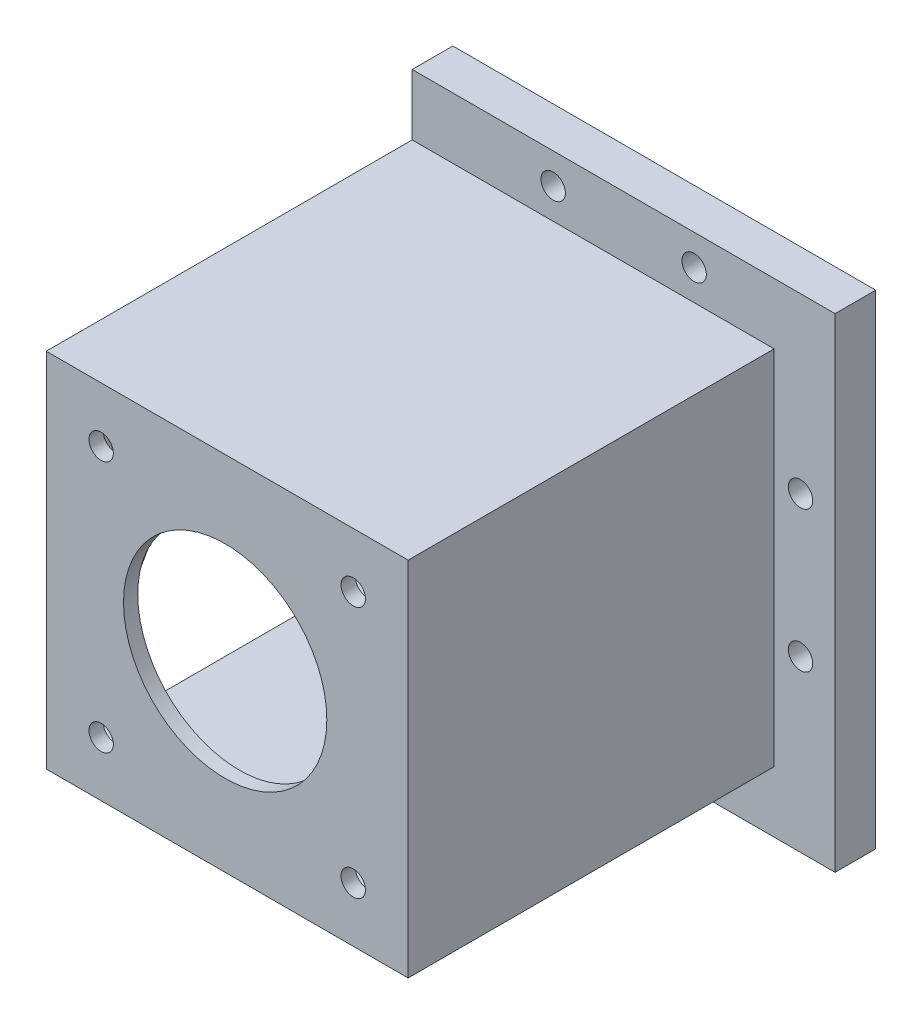
from build123d import *

# Parameters (mm, degrees)
SKETCH6_R           = 1.5
BOSS_EXTRUDE4_DEPTH = 5
SKETCH8_W           = 44.5
SKETCH8_H           = 44.5
SKETCH8_R           = 1.5
SKETCH8_R_2         = 12.5
BOSS_EXTRUDE5_DEPTH = 50
SKETCH7_W           = 43.5
SKETCH7_H           = 42.5
CUT_EXTRUDE4_DEPTH  = 48.25
BOSS_EXTRUDE6_DEPTH = 1


with BuildPart() as part:
    # Sketch6 → Boss-Extrude4 (new body)
    with BuildSketch(Plane.XY):
        Polygon((-437.521213625, -225.081134847), (-482.021213625, -225.081134847), (-482.021213625, -232.581134847), (-430.021213625, -232.581134847), (-430.021213625, -173.081134847), (-482.021213625, -173.081134847), (-482.021213625, -180.581134847), (-437.521213625, -180.581134847), align=None)
        with Locations((-464.687880625, -228.331134847)):
            Circle(SKETCH6_R, mode=Mode.SUBTRACT)
        with Locations((-447.354547625, -228.331134847)):
            Circle(SKETCH6_R, mode=Mode.SUBTRACT)
        with Locations((-434.271213625, -211.715651861)):
            Circle(SKETCH6_R, mode=Mode.SUBTRACT)
        with Locations((-464.687883625, -176.831134847)):
            Circle(SKETCH6_R, mode=Mode.SUBTRACT)
        with Locations((-434.271213625, -194.382318861)):
            Circle(SKETCH6_R, mode=Mode.SUBTRACT)
        with Locations((-447.354550625, -176.831134847)):
            Circle(SKETCH6_R, mode=Mode.SUBTRACT)
    extrude(amount=BOSS_EXTRUDE4_DEPTH)

    # Sketch8 → Boss-Extrude5 (add)
    with BuildSketch(Plane.XY):
        with Locations((-459.771213625, -202.831134847)):
            Rectangle(SKETCH8_W, SKETCH8_H)
        with Locations((-475.271213625, -218.331134847)):
            Circle(SKETCH8_R, mode=Mode.SUBTRACT)
        with Locations((-444.271213625, -218.331134847)):
            Circle(SKETCH8_R, mode=Mode.SUBTRACT)
        with Locations((-444.271213625, -187.331134847)):
            Circle(SKETCH8_R, mode=Mode.SUBTRACT)
        with Locations((-475.271213625, -187.331134847)):
            Circle(SKETCH8_R, mode=Mode.SUBTRACT)
        with Locations((-460.021213625, -202.581134847)):
            Circle(SKETCH8_R_2, mode=Mode.SUBTRACT)
    extrude(amount=BOSS_EXTRUDE5_DEPTH)

    # Sketch7 → Cut-Extrude4 (cut)
    with BuildSketch(Plane.XY):
        with Locations((-460.271213625, -202.831134847)):
            Rectangle(SKETCH7_W, SKETCH7_H)
    extrude(amount=CUT_EXTRUDE4_DEPTH, mode=Mode.SUBTRACT)

    # Sketch10 → Boss-Extrude6 (add)
    with BuildSketch(Plane.ZY.offset(482.021213625)):
        Polygon((24.125, -181.581134847), (48.25, -224.081134847), (48.25, -181.581134847), align=None)
    extrude(amount=-BOSS_EXTRUDE6_DEPTH)


solid = part.part
